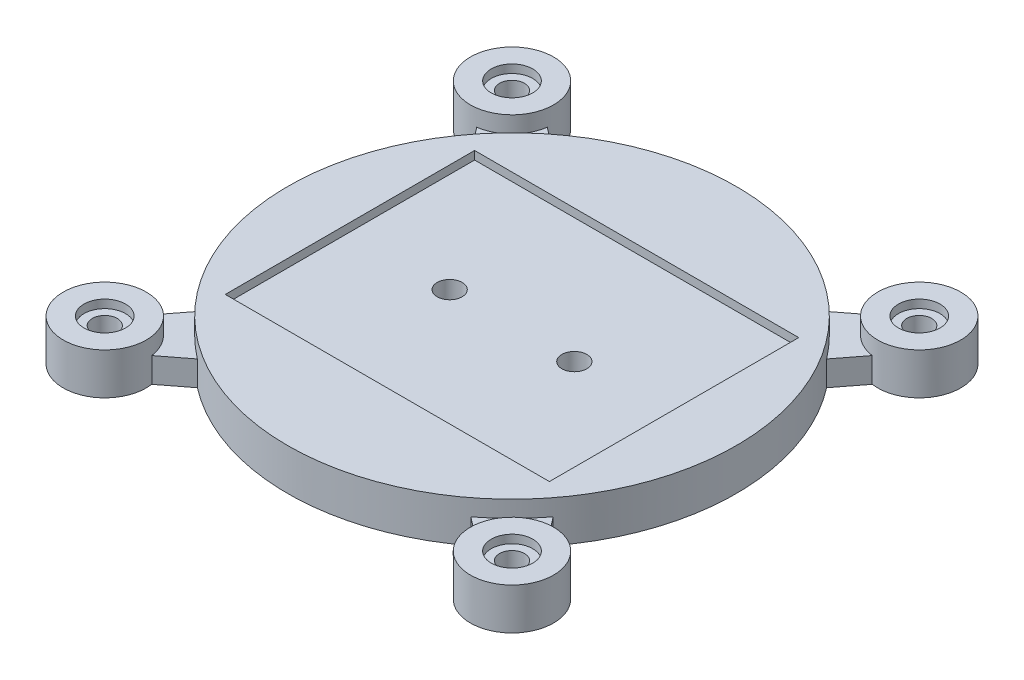
from build123d import *

# Parameters (mm, degrees)
SKETCH1_R                               = 27
BOSS_EXTRUDE1_DEPTH                     = 5
BOSS_EXTRUDE3_DEPTH                     = 3
SKETCH2_3_R                             = 5
BOSS_EXTRUDE4_DEPTH                     = 5
CBORE_FOR_M5_HEX_HEAD_BOLT1_D           = 3
CBORE_FOR_M5_HEX_HEAD_BOLT1_CBORE_D     = 5
CBORE_FOR_M5_HEX_HEAD_BOLT1_CBORE_DEPTH = 1
SKETCH5_W                               = 39
SKETCH5_H                               = 30
CUT_EXTRUDE1_DEPTH                      = 1
SKETCH6_R                               = 1.5
CUT_EXTRUDE2_DEPTH                      = 42.910619179
CIRPATTERN1_COUNT                       = 4


with BuildPart() as part:
    # Sketch1 → Boss-Extrude1 (new body)
    with BuildSketch(Plane(origin=(0, 0, 0), x_dir=(1, 0, 0), z_dir=(0, 1, 0))):
        with Locations(Location((0, 0, 0), (0, 0, 270))):
            Circle(SKETCH1_R)
    extrude(amount=BOSS_EXTRUDE1_DEPTH)

    # Sketch2 → Boss-Extrude3 (add)
    with BuildSketch(Plane(origin=(0, 0, 0), x_dir=(1, 0, 0), z_dir=(0, 1, 0))):
        with BuildLine():
            ThreePointArc((-19.550252532, 23.792893219), (-20.964466094, 20.964466094), (-23.792893219, 19.550252532))
            Line((-23.792893219, 19.550252532), (-21.405668752, 16.455921283))
            ThreePointArc((-21.405668752, 16.455921283), (-19.091883092, 19.091883092), (-16.455921283, 21.405668752))
            Line((-16.455921283, 21.405668752), (-19.550252532, 23.792893219))
        make_face()
    boss_extrude3 = extrude(amount=BOSS_EXTRUDE3_DEPTH)

    # Sketch2<3> → Boss-Extrude4 (add, through all)
    with BuildSketch(Plane(origin=(0, 0, 0), x_dir=(1, 0, 0), z_dir=(0, 1, 0))):
        with Locations(Location((-24.5, 24.5, 0), (0, 0, 351.869897646))):
            Circle(SKETCH2_3_R)
    boss_extrude4 = extrude(amount=BOSS_EXTRUDE4_DEPTH)

    # CBORE for M5 Hex Head Bolt1 (through all)
    with Locations(Plane(origin=(0, 5, 0), x_dir=(1, 0, 0), z_dir=(0, 1, 0))):
        with Locations((-24.5, 24.5)):
            cbore_for_m5_hex_head_bolt1 = CounterBoreHole(CBORE_FOR_M5_HEX_HEAD_BOLT1_D / 2, CBORE_FOR_M5_HEX_HEAD_BOLT1_CBORE_D / 2, CBORE_FOR_M5_HEX_HEAD_BOLT1_CBORE_DEPTH)

    # Sketch5 → Cut-Extrude1 (cut)
    with BuildSketch(Plane(origin=(0, 5, 0), x_dir=(1, 0, 0), z_dir=(0, 1, 0))):
        Rectangle(SKETCH5_W, SKETCH5_H)
    extrude(amount=-CUT_EXTRUDE1_DEPTH, mode=Mode.SUBTRACT)

    # Sketch6 → Cut-Extrude2 (cut, through all)
    with BuildSketch(Plane(origin=(0, 4, 0), x_dir=(1, 0, 0), z_dir=(0, 1, 0))):
        with Locations(Location((-7.5, 0, 0), (0, 0, 270))):
            Circle(SKETCH6_R)
        with Locations(Location((7.5, 0, 0), (0, 0, 90))):
            Circle(SKETCH6_R)
    extrude(amount=-CUT_EXTRUDE2_DEPTH, mode=Mode.SUBTRACT)

    # CirPattern1: Boss-Extrude3, Boss-Extrude4, CBORE for M5 Hex Head Bolt1 ×4 about axis
    cirpattern1_axis = Axis((0, 0, 0), (0, 1, 0))
    add([boss_extrude3.rotate(cirpattern1_axis, i * 360 / CIRPATTERN1_COUNT) for i in range(1, CIRPATTERN1_COUNT)])
    add([boss_extrude4.rotate(cirpattern1_axis, i * 360 / CIRPATTERN1_COUNT) for i in range(1, CIRPATTERN1_COUNT)])
    add([cbore_for_m5_hex_head_bolt1.rotate(cirpattern1_axis, i * 360 / CIRPATTERN1_COUNT) for i in range(1, CIRPATTERN1_COUNT)], mode=Mode.SUBTRACT)


solid = part.part
